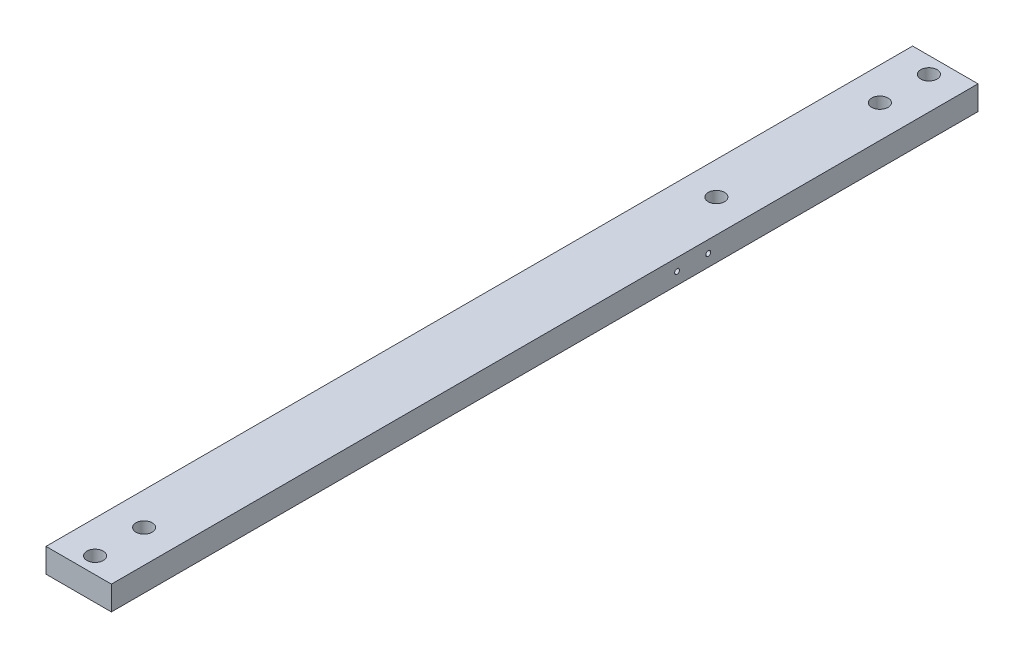
from build123d import *

# Parameters (mm, degrees)
SKETCH_1_W          = 8
SKETCH_1_H          = 106
EXTRUDE_1_DEPTH     = 2.95
SKETCH_2_R          = 0.7
CUT_EXTRUDE_1_DEPTH = 107.342383366
SKETCH_2_3_R        = 1
CUT_EXTRUDE_2_DEPTH = 1.5
SKETCH_3_R          = 0.3
CUT_EXTRUDE_3_DEPTH = 107.342383366


with BuildPart() as part:
    # 草图1 → 凸台-拉伸1 (new body)
    with BuildSketch(Plane(origin=(0, 0, 0), x_dir=(1, 0, 0), z_dir=(0, 1, 0))):
        with Locations((4, -53)):
            Rectangle(SKETCH_1_W, SKETCH_1_H)
    extrude(amount=EXTRUDE_1_DEPTH)

    # 草图2 → 切除-拉伸1 (cut, through all)
    with BuildSketch(Plane(origin=(0, 2.95, 0), x_dir=(1, 0, 0), z_dir=(0, 1, 0))):
        with Locations((4, -8)):
            Circle(SKETCH_2_R)
        with Locations((4, -2)):
            Circle(SKETCH_2_R)
        with Locations((4, -104)):
            Circle(SKETCH_2_R)
        with Locations((4, -98)):
            Circle(SKETCH_2_R)
        with Locations((4, -28)):
            Circle(SKETCH_2_R)
    extrude(amount=-CUT_EXTRUDE_1_DEPTH, mode=Mode.SUBTRACT)

    # 草图2<3> → 切除-拉伸2 (cut)
    with BuildSketch(Plane(origin=(0, 2.95, 0), x_dir=(1, 0, 0), z_dir=(0, 1, 0))):
        with Locations((4, -8)):
            Circle(SKETCH_2_3_R)
        with Locations((4, -2)):
            Circle(SKETCH_2_3_R)
        with Locations((4, -104)):
            Circle(SKETCH_2_3_R)
        with Locations((4, -98)):
            Circle(SKETCH_2_3_R)
        with Locations((4, -28)):
            Circle(SKETCH_2_3_R)
    extrude(amount=-CUT_EXTRUDE_2_DEPTH, mode=Mode.SUBTRACT)

    # 草图3 → 切除-拉伸3 (cut, through all)
    with BuildSketch(Plane(origin=(8, 0, 0), x_dir=(0, 0, -1), z_dir=(1, 0, 0))):
        with Locations((-33, 1.475)):
            Circle(SKETCH_3_R)
        with Locations((-36.8, 1.475)):
            Circle(SKETCH_3_R)
    extrude(amount=-CUT_EXTRUDE_3_DEPTH, mode=Mode.SUBTRACT)


solid = part.part
